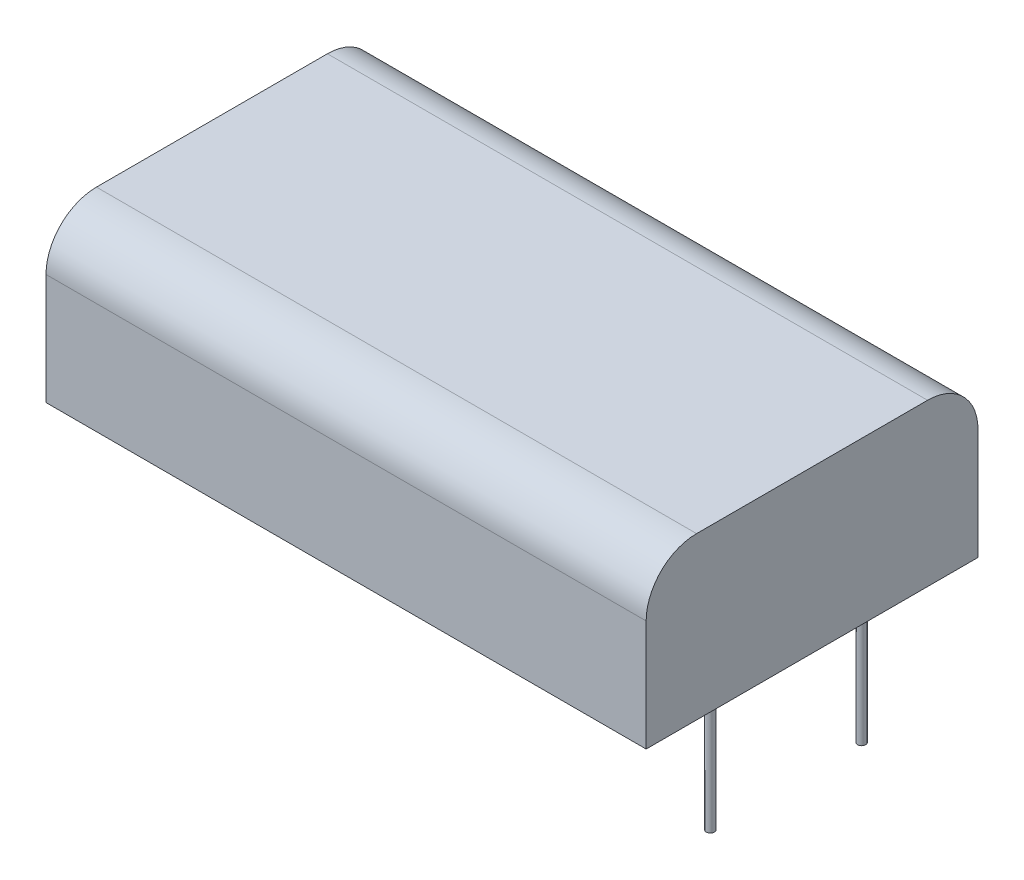
from build123d import *

# Parameters (mm, degrees)
SKETCH1_W           = 59.5
SKETCH1_H           = 32.9
BOSS_EXTRUDE1_DEPTH = 16
FILLET1_R           = 5
SKETCH2_R           = 0.4
BOSS_EXTRUDE2_DEPTH = 12.7


with BuildPart() as part:
    # Sketch1 → Boss-Extrude1 (new body)
    with BuildSketch(Plane(origin=(0, 0, 0), x_dir=(1, 0, 0), z_dir=(0, 1, 0))):
        Rectangle(SKETCH1_W, SKETCH1_H)
    extrude(amount=BOSS_EXTRUDE1_DEPTH)

    # Fillet1
    fillet1_edges = [part.edges().sort_by_distance(p)[0] for p in [
        (0, 16, 16.45),
        (0, 16, -16.45),
    ]]
    fillet(fillet1_edges, radius=FILLET1_R)

    # Sketch2 → Boss-Extrude2 (add)
    with BuildSketch(Plane.XZ):
        with Locations(Location((27.165, 7.5, 0), (0, 0, 270))):
            Circle(SKETCH2_R)
        with Locations(Location((27.165, -7.5, 0), (0, 0, 270))):
            Circle(SKETCH2_R)
    extrude(amount=BOSS_EXTRUDE2_DEPTH)


solid = part.part
